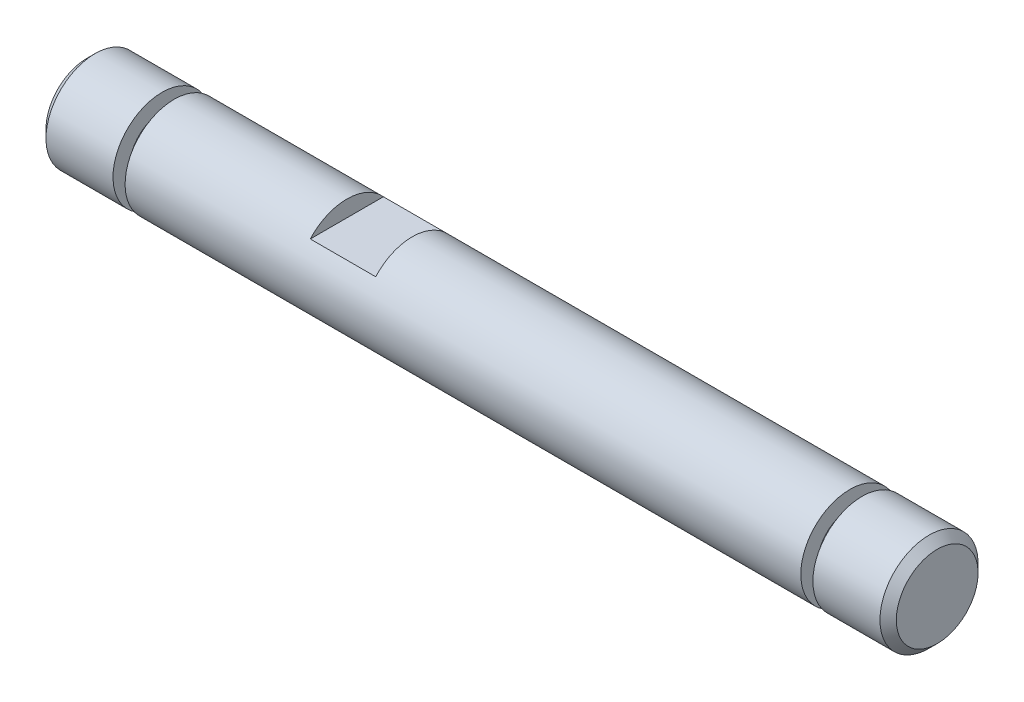
from build123d import *

# Parameters (mm, degrees)
ESQUISSE1_W                  = 52
ESQUISSE1_H                  = 3
CHANFREIN1_SIZE              = 0.5
ENL_V_MAT_EXTRU_1_DEPTH      = 27.343879745
ENL_V_MAT_EXTRU_1_DEPTH_BACK = 27.343879745
ESQUISSE2_W                  = 4
ESQUISSE2_H                  = 2
ESQUISSE3_W                  = 0.74
ESQUISSE3_H                  = 1


with BuildPart() as part:
    # Esquisse1 → Révolution1 (revolve)
    with BuildSketch(Plane.XY, mode=Mode.PRIVATE) as r_volution1_sk:
        with Locations((0, 1.5)):
            Rectangle(ESQUISSE1_W, ESQUISSE1_H)
    revolve(r_volution1_sk.sketch.rotate(Axis((0, 0, 0), (1, 0, 0)), 90), axis=Axis((0, 0, 0), (1, 0, 0)))

    # Chanfrein1
    chanfrein1_edges = [part.edges().sort_by_distance(p)[0] for p in [
        (26, 0, -3),
        (-26, 0, -3),
    ]]
    chamfer(chanfrein1_edges, length=CHANFREIN1_SIZE)

    # Esquisse2 → Enlèv. mat.-Extru.1 (cut, two sides: drawn at the far end of the back side and taken through both)
    with BuildSketch(Plane.XY.offset(-ENL_V_MAT_EXTRU_1_DEPTH_BACK)):
        with Locations((-8.1, 3)):
            Rectangle(ESQUISSE2_W, ESQUISSE2_H)
    extrude(amount=ENL_V_MAT_EXTRU_1_DEPTH + ENL_V_MAT_EXTRU_1_DEPTH_BACK, mode=Mode.SUBTRACT)

    # Esquisse3 → Enlèvement de matière-Révolution1 (revolve, cut)
    with BuildSketch(Plane.XY):
        with Locations((-21.03, 2.5)):
            Rectangle(ESQUISSE3_W, ESQUISSE3_H)
        with Locations((21.03, 2.5)):
            Rectangle(ESQUISSE3_W, ESQUISSE3_H)
    revolve(axis=Axis((0, 0, 0), (-1, 0, 0)), mode=Mode.SUBTRACT)


solid = part.part
